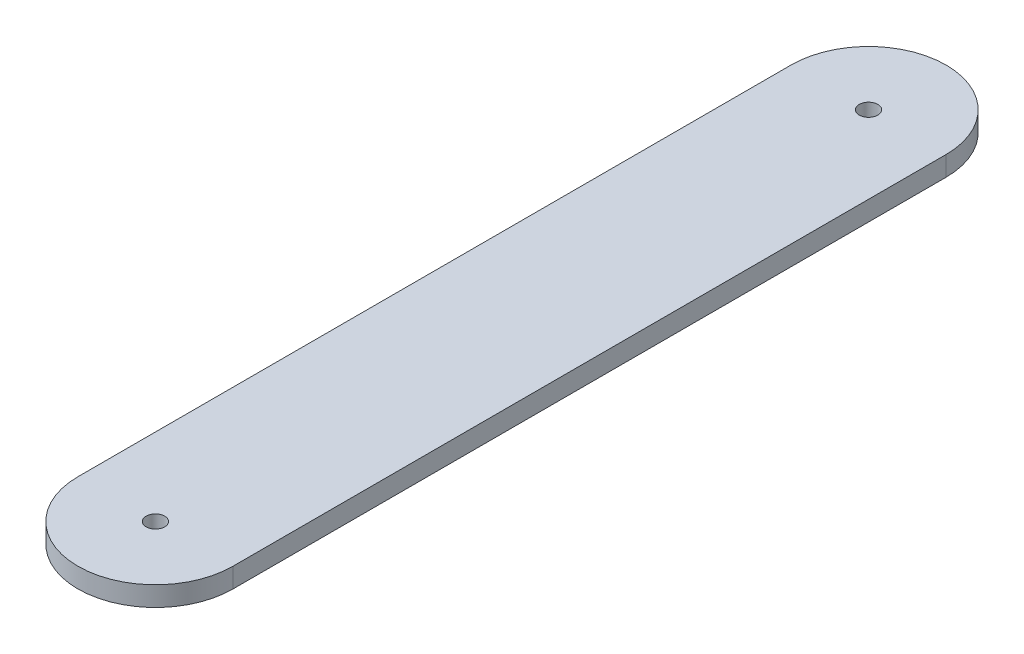
from build123d import *

# Parameters (mm, degrees)
SKETCH1_R           = 1.5
BOSS_EXTRUDE1_DEPTH = 3.18


with BuildPart() as part:
    # Sketch1 → Boss-Extrude1 (new body)
    with BuildSketch(Plane(origin=(0, 0, 0), x_dir=(1, 0, 0), z_dir=(0, 1, 0))):
        with BuildLine():
            Line((-12.5, 0), (-12.5, 115))
            ThreePointArc((-12.5, 115), (0, 127.5), (12.5, 115))
            Line((12.5, 115), (12.5, 0))
            ThreePointArc((12.5, 0), (0, -12.5), (-12.5, 0))
        make_face()
        with Locations(Location((0, 115, 0), (0, 0, 90))):
            Circle(SKETCH1_R, mode=Mode.SUBTRACT)
        with Locations(Location((0, 0, 0), (0, 0, 90))):
            Circle(SKETCH1_R, mode=Mode.SUBTRACT)
    extrude(amount=BOSS_EXTRUDE1_DEPTH)


solid = part.part
